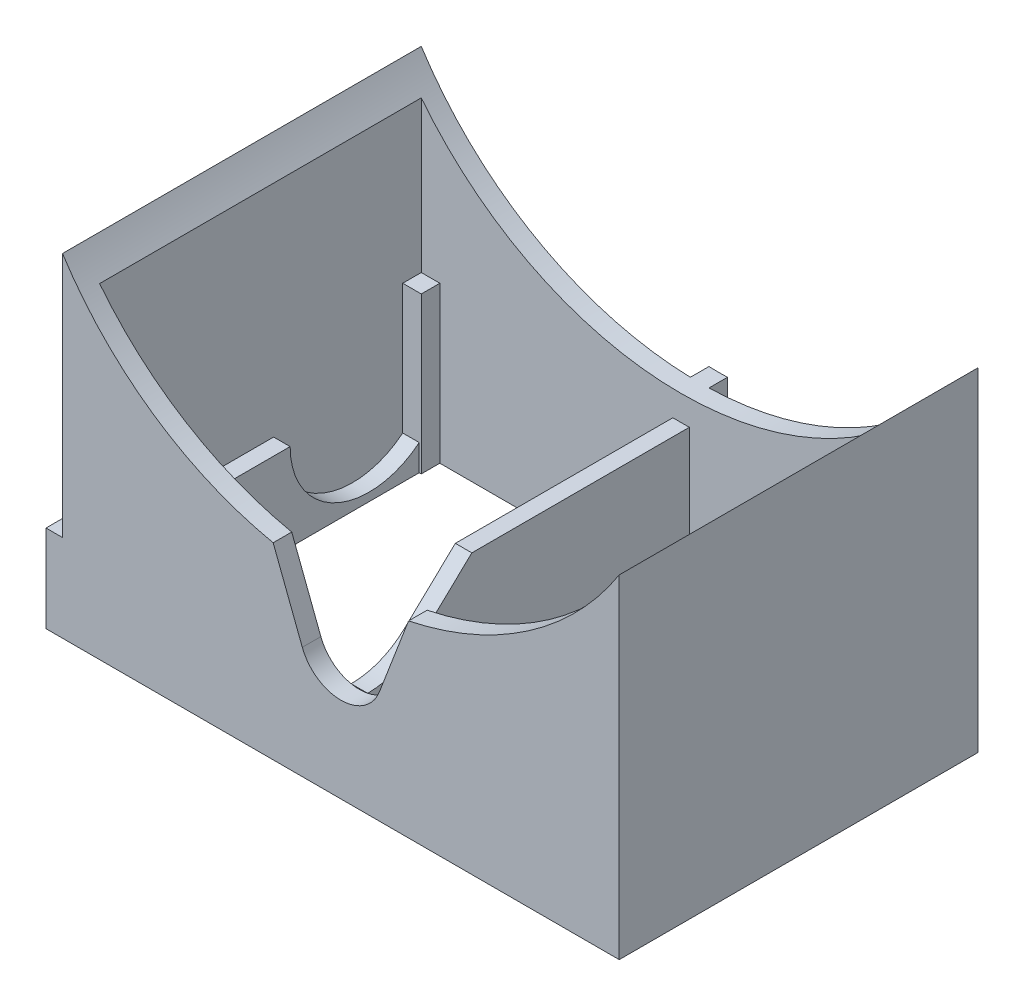
from build123d import *

# Parameters (mm, degrees)
SKETCH_1_W          = 135
SKETCH_1_H          = 87
EXTRUDE_1_DEPTH     = 37.8
SKETCH_2_W          = 135
SKETCH_2_H          = 87
SKETCH_2_W_2        = 126
SKETCH_2_H_2        = 78
EXTRUDE_2_DEPTH     = 43
CUT_EXTRUDE_1_DEPTH = 177.430978006
CUT_EXTRUDE_2_DEPTH = 4.5
CUT_EXTRUDE_3_DEPTH = 4.5
EXTRUDE_3_DEPTH     = 4.5
EXTRUDE_4_DEPTH     = 4
EXTRUDE_5_DEPTH     = 4


with BuildPart() as part:
    # 草图1 → 凸台-拉伸1 (new body)
    with BuildSketch(Plane(origin=(0, 0, 0), x_dir=(1, 0, 0), z_dir=(0, 1, 0))):
        with Locations((63, -34.5)):
            Rectangle(SKETCH_1_W, SKETCH_1_H)
        Polygon((0, 0), (4.5, 0), (4.5, 4.5), (61, 4.5), (61, -73.5), (4.5, -73.5), (4.5, -69), (0, -69), align=None, mode=Mode.SUBTRACT)
        Polygon((121.5, 4.5), (121.5, 0), (126, 0), (126, -69), (121.5, -69), (121.5, -73.5), (65, -73.5), (65, 4.5), align=None, mode=Mode.SUBTRACT)
    extrude(amount=EXTRUDE_1_DEPTH)

    # 草图2 → 凸台-拉伸2 (add)
    with BuildSketch(Plane(origin=(0, 37.8, 0), x_dir=(1, 0, 0), z_dir=(0, 1, 0))):
        with Locations((63, -34.5)):
            Rectangle(SKETCH_2_W, SKETCH_2_H)
        with Locations((63, -34.5)):
            Rectangle(SKETCH_2_W_2, SKETCH_2_H_2, mode=Mode.SUBTRACT)
    extrude(amount=EXTRUDE_2_DEPTH)

    # 草图3 → 切除-拉伸1 (cut, through all)
    with BuildSketch(Plane.XY.offset(78)):
        with BuildLine():
            Line((-4.5, 80.8), (130.5, 80.8))
            ThreePointArc((130.5, 80.8), (63, 43.9), (-4.5, 80.8))
        make_face()
    extrude(amount=-CUT_EXTRUDE_1_DEPTH, mode=Mode.SUBTRACT)

    # 草图4 → 切除-拉伸2 (cut)
    with BuildSketch(Plane.XY.offset(78)):
        with BuildLine():
            Line((53.65, 27.169085989), (46.585, 45.598112395))
            Line((46.585, 45.598112395), (79.415, 45.598112395))
            Line((79.415, 45.598112395), (72.35, 27.169085989))
            ThreePointArc((72.35, 27.169085989), (63, 20.74), (53.65, 27.169085989))
        make_face()
    extrude(amount=-CUT_EXTRUDE_2_DEPTH, mode=Mode.SUBTRACT)

    # 草图5 → 切除-拉伸3 (cut)
    with BuildSketch(Plane(origin=(65, 0, 0), x_dir=(0, 0, -1), z_dir=(1, 0, 0))):
        with BuildLine():
            Line((-73.5, 37.8), (-48.24, 37.8))
            Line((-48.24, 37.8), (-60.563675282, 26.103423436))
            ThreePointArc((-60.563675282, 26.103423436), (-66.535963079, 22.279815799), (-73.5, 20.94176249))
            Line((-73.5, 20.94176249), (-73.5, 37.8))
        make_face()
    extrude(amount=-CUT_EXTRUDE_3_DEPTH, mode=Mode.SUBTRACT)

    # 草图6 → 凸台-拉伸3 (add)
    with BuildSketch(Plane(origin=(0, 0, -9), x_dir=(-1, 0, 0), z_dir=(0, 0, -1))):
        with BuildLine():
            Line((-65.25, 0), (-60.75, 0))
            Line((-60.75, 0), (-60.75, 43.931572736))
            ThreePointArc((-60.75, 43.931572736), (-63, 43.9), (-65.25, 43.931572736))
            Line((-65.25, 43.931572736), (-65.25, 0))
        make_face()
    extrude(amount=EXTRUDE_3_DEPTH)

    # 草图7 → 凸台-拉伸4 (add)
    with BuildSketch(Plane.ZY.offset(4.5)):
        with BuildLine():
            Line((-9, 0), (12.15, 0))
            ThreePointArc((12.15, 0), (-2.805308422, 6.194691578), (-9, 21.15))
            Line((-9, 21.15), (-9, 0))
        make_face()
        with BuildLine():
            Line((78, 0), (78, 21.15))
            Line((78, 21.15), (43.3, 21.15))
            ThreePointArc((43.3, 21.15), (37.105308422, 6.194691578), (22.15, 0))
            Line((22.15, 0), (78, 0))
        make_face()
    extrude(amount=EXTRUDE_4_DEPTH)

    # 草图8 → 凸台-拉伸5 (add)
    with BuildSketch(Plane(origin=(0, 0, 0), x_dir=(0, 0, -1), z_dir=(1, 0, 0))):
        with BuildLine():
            Line((0, 6.347973112), (0, 0))
            Line((0, 0), (-31.3, 0))
            Line((-31.3, 0), (-69, 0))
            Line((-69, 0), (-69, 21.15))
            Line((-69, 21.15), (-31.3, 21.15))
            ThreePointArc((-31.3, 21.15), (-20.336879747, 3.83822655), (0, 6.347973112))
        make_face()
    extrude(amount=EXTRUDE_5_DEPTH)


solid = part.part
